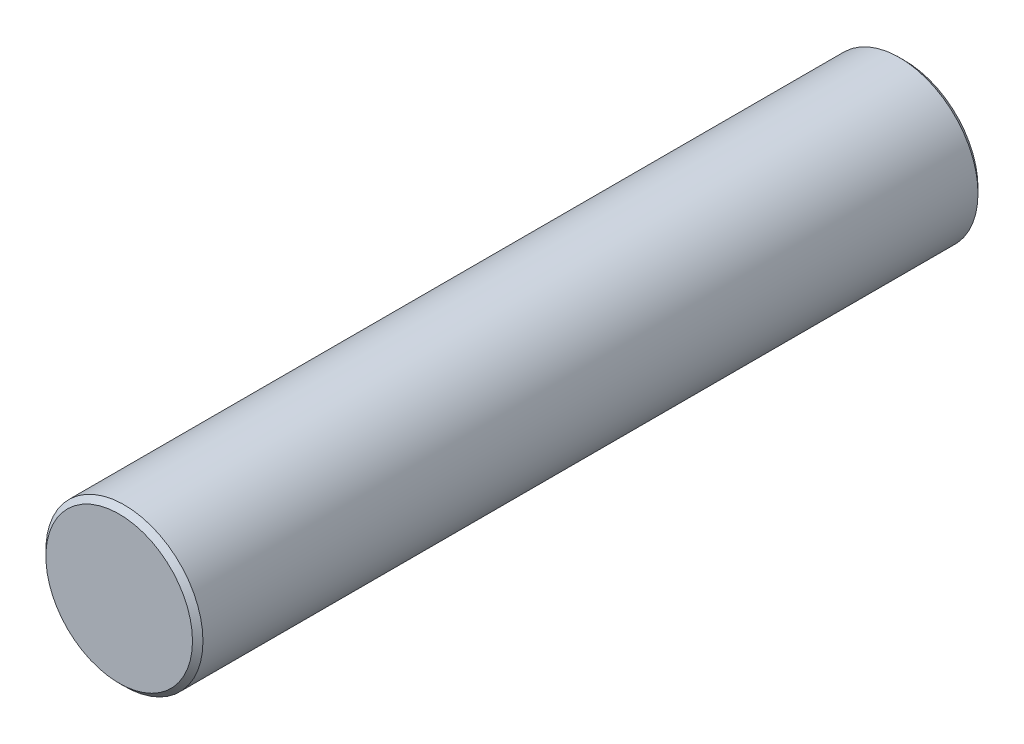
from build123d import *

# Parameters (mm, degrees)
ESQUISSE1_R        = 1.5
BOSS_EXTRU_1_DEPTH = 15
CHANFREIN1_SIZE    = 0.1


with BuildPart() as part:
    # Esquisse1 → Boss.-Extru.1 (new body)
    with BuildSketch(Plane.XY):
        Circle(ESQUISSE1_R)
    extrude(amount=BOSS_EXTRU_1_DEPTH)

    # Chanfrein1
    chanfrein1_edges = [part.edges().sort_by_distance(p)[0] for p in [
        (-1.5, 0, 0),
        (-1.5, 0, 15),
    ]]
    chamfer(chanfrein1_edges, length=CHANFREIN1_SIZE)


solid = part.part
